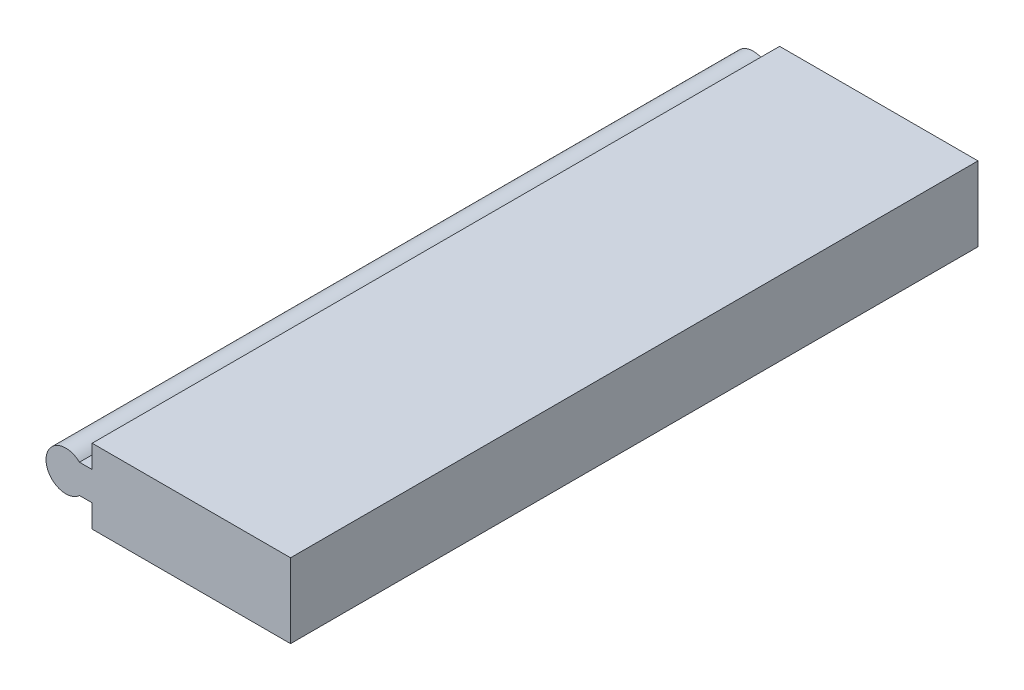
from build123d import *

# Parameters (mm, degrees)
BOSS_EXTRUDE1_DEPTH = 69.3


with BuildPart() as part:
    # Sketch1 → Boss-Extrude1 (new body)
    with BuildSketch(Plane.XY):
        with BuildLine():
            Line((1.373716035, 1.453583247), (2.651591417, 1.453583247))
            Line((2.651591417, 1.453583247), (2.651591417, 3.75))
            Line((2.651591417, 3.75), (22.651591417, 3.75))
            Line((22.651591417, 3.75), (22.651591417, -3.75))
            Line((22.651591417, -3.75), (2.651591417, -3.75))
            Line((2.651591417, -3.75), (2.651591417, -1.453583247))
            Line((2.651591417, -1.453583247), (1.373716035, -1.453583247))
            ThreePointArc((1.373716035, -1.453583247), (-2, 0), (1.373716035, 1.453583247))
        make_face()
    extrude(amount=BOSS_EXTRUDE1_DEPTH)


solid = part.part
